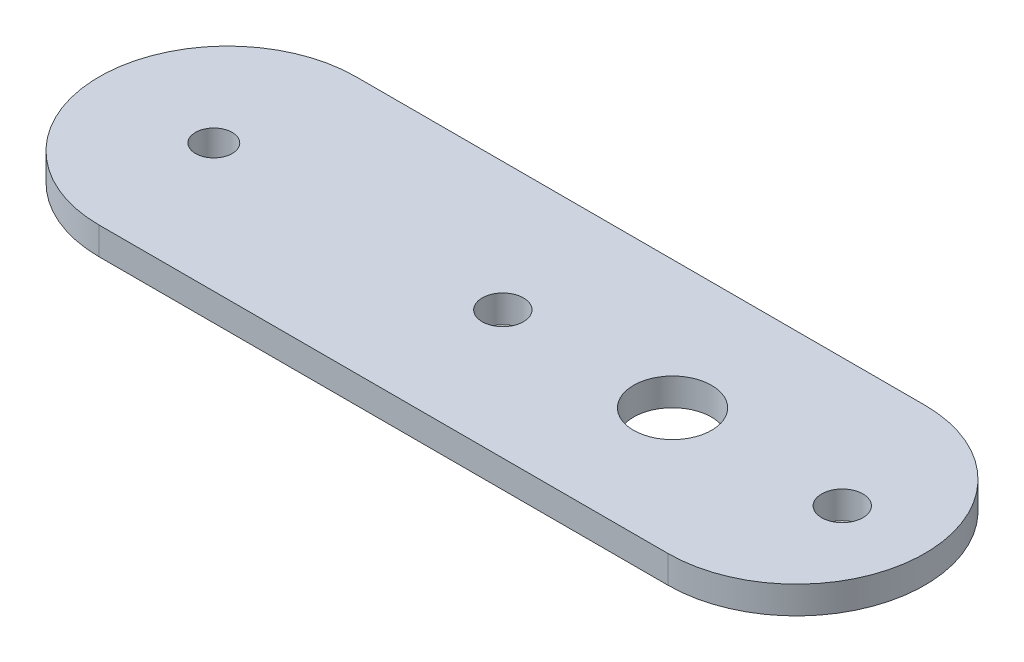
from build123d import *

# Parameters (mm, degrees)
SKETCH_1_W          = 90
SKETCH_1_H          = 28
SKETCH_1_R          = 4.25
SKETCH_1_R_2        = 2
EXTRUDE_1_DEPTH     = 3
CUT_EXTRUDE_1_REACH = 49.223
SKETCH_3_R          = 2.25
FILLET_1_RADIUS     = 14
FILLET_1_LENGTH     = 3
FILLET_2_RADIUS     = 14
FILLET_2_LENGTH     = 3


with BuildPart() as part:
    # 草图1 → 凸台-拉伸1 (new body)
    with BuildSketch(Plane(origin=(0, 0, 0), x_dir=(1, 0, 0), z_dir=(0, 1, 0))):
        Rectangle(SKETCH_1_W, SKETCH_1_H)
        with Locations(Location((17.5, 0, 0), (0, 0, 270))):
            Circle(SKETCH_1_R, mode=Mode.SUBTRACT)
        with Locations(Location((-32.5, 0, 0), (0, 0, 270))):
            Circle(SKETCH_1_R_2, mode=Mode.SUBTRACT)
    extrude(amount=EXTRUDE_1_DEPTH)

    # 草图3 → 切除-拉伸1 (cut, up to next)
    with BuildSketch(Plane(origin=(0, 3, 0), x_dir=(1, 0, 0), z_dir=(0, 1, 0)), mode=Mode.PRIVATE) as cut_extrude_1_sk1:
        with Locations(Location((36, 0, 0), (0, 0, 270))):
            Circle(SKETCH_3_R)
    cut_extrude_1_tool1 = extrude(cut_extrude_1_sk1.sketch, amount=-CUT_EXTRUDE_1_REACH, mode=Mode.PRIVATE) & part.part
    # 草图3 → 切除-拉伸1 (cut, up to next)
    with BuildSketch(Plane(origin=(0, 3, 0), x_dir=(1, 0, 0), z_dir=(0, 1, 0)), mode=Mode.PRIVATE) as cut_extrude_1_sk2:
        with Locations(Location((-1, 0, 0), (0, 0, 270))):
            Circle(SKETCH_3_R)
    cut_extrude_1_tool2 = extrude(cut_extrude_1_sk2.sketch, amount=-CUT_EXTRUDE_1_REACH, mode=Mode.PRIVATE) & part.part
    add(cut_extrude_1_tool1.solids().sort_by_distance((36, 3, 0))[0], mode=Mode.SUBTRACT)
    add(cut_extrude_1_tool2.solids().sort_by_distance((-1, 3, 0))[0], mode=Mode.SUBTRACT)

    # 圆角1: full round fillet: the end face becomes a half cylinder, R = half its width
    fillet_1_face = Plane((45, 1.5, 0), x_dir=(0, -1, 0), z_dir=(1, 0, 0))  # on the end face: x along it, z out of the body
    fillet_1_slab = fillet_1_face.offset(-FILLET_1_RADIUS / 2) * Box(FILLET_1_LENGTH, 2 * FILLET_1_RADIUS, FILLET_1_RADIUS, mode=Mode.PRIVATE)  # the body's end, R deep
    fillet_1_round = Plane((31, 1.5, 0), x_dir=(1, 0, 0), z_dir=(0, -1, 0)) * Cylinder(FILLET_1_RADIUS, FILLET_1_LENGTH, mode=Mode.PRIVATE)  # its axis R under the face
    add(fillet_1_slab - fillet_1_round, mode=Mode.SUBTRACT)

    # 圆角2: full round fillet: the end face becomes a half cylinder, R = half its width
    fillet_2_face = Plane((-45, 1.5, 0), x_dir=(0, 1, 0), z_dir=(-1, 0, 0))  # on the end face: x along it, z out of the body
    fillet_2_slab = fillet_2_face.offset(-FILLET_2_RADIUS / 2) * Box(FILLET_2_LENGTH, 2 * FILLET_2_RADIUS, FILLET_2_RADIUS, mode=Mode.PRIVATE)  # the body's end, R deep
    fillet_2_round = Plane((-31, 1.5, 0), x_dir=(-1, 0, 0), z_dir=(0, 1, 0)) * Cylinder(FILLET_2_RADIUS, FILLET_2_LENGTH, mode=Mode.PRIVATE)  # its axis R under the face
    add(fillet_2_slab - fillet_2_round, mode=Mode.SUBTRACT)


solid = part.part
